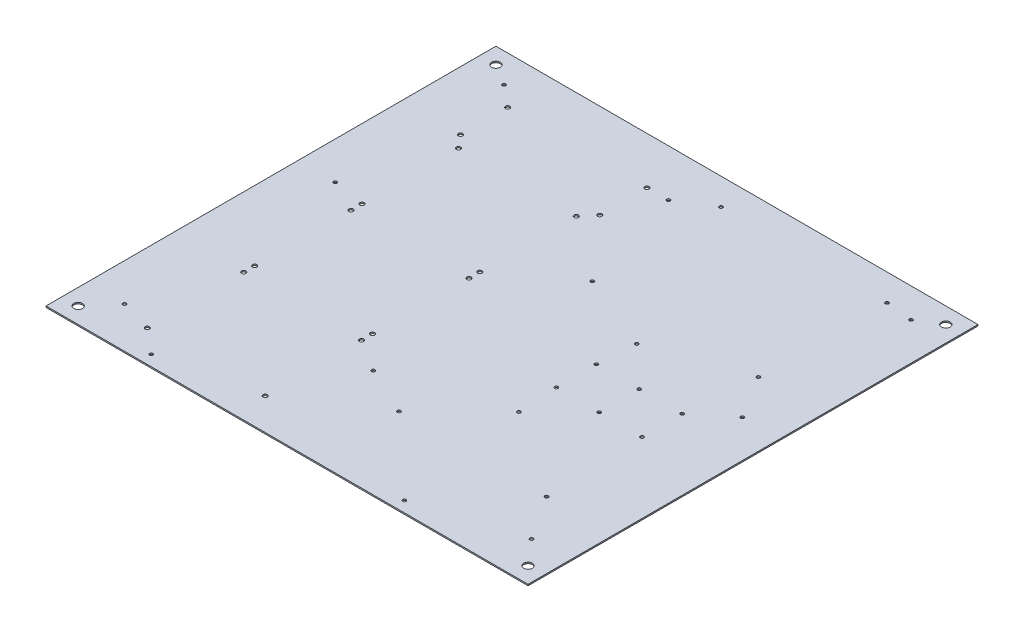
from build123d import *

# Parameters (mm, degrees)
SKETCH1_W               = 571.5
SKETCH1_H               = 533.4
BOSS_EXTRUDE1_DEPTH     = 1.5875
F_10_32_TAPPED_HOLE1_D  = 4.0386
F_1_4_20_TAPPED_HOLE1_D = 5.1054
F_10_32_TAPPED_HOLE2_D  = 4.0386
F_10_32_TAPPED_HOLE3_D  = 4.0386
F_3_8_CLEARANCE_HOLE1_D = 10.31748
F_10_32_TAPPED_HOLE4_D  = 4.0386


with BuildPart() as part:
    # Sketch1 → Boss-Extrude1 (new body)
    with BuildSketch(Plane(origin=(0, 0, 0), x_dir=(1, 0, 0), z_dir=(0, 1, 0))):
        with Locations((285.75, 266.7)):
            Rectangle(SKETCH1_W, SKETCH1_H)
    extrude(amount=BOSS_EXTRUDE1_DEPTH)

    # #10-32 Tapped Hole1 (through all)
    with Locations(Plane(origin=(0, 1.5875, 0), x_dir=(1, 0, 0), z_dir=(0, 1, 0))):
        with Locations((298.45, 501.65), (495.3, 501.65), (298.45, 349.25), (495.3, 349.25)):
            Hole(F_10_32_TAPPED_HOLE1_D / 2)

    # 1/4-20 Tapped Hole1 (through all)
    with Locations(Plane(origin=(0, 1.5875, 0), x_dir=(1, 0, 0), z_dir=(0, 1, 0))):
        with Locations((82.55, 406.4), (82.55, 292.1), (222.25, 292.1), (222.25, 406.4), (82.55, 279.146), (82.55, 164.846), (222.25, 164.846), (222.25, 279.146), (82.55, 151.892), (82.55, 37.592), (222.25, 37.592), (222.25, 151.892), (69.85, 477.52), (234.95, 421.64), (69.85, 421.64), (234.95, 477.52)):
            Hole(F_1_4_20_TAPPED_HOLE1_D / 2)

    # #10-32 Tapped Hole2 (through all)
    with Locations(Plane(origin=(0, 1.5875, 0), x_dir=(1, 0, 0), z_dir=(0, 1, 0))):
        with Locations((386.19999976, 266.324), (386.19999976, 218.826), (436.99999976, 266.324), (436.99999976, 218.826), (487.79999976, 266.324), (487.79999976, 218.826)):
            Hole(F_10_32_TAPPED_HOLE2_D / 2)

    # #10-32 Tapped Hole3 (through all)
    with Locations(Plane(origin=(0, 1.5875, 0), x_dir=(1, 0, 0), z_dir=(0, 1, 0))):
        with Locations((317.5, 100.975), (492.506, 100.975)):
            Hole(F_10_32_TAPPED_HOLE3_D / 2)

    # 3/8 Clearance Hole1 (through all)
    with Locations(Plane(origin=(0, 1.5875, 0), x_dir=(1, 0, 0), z_dir=(0, 1, 0))):
        with Locations((19.05, 514.35), (552.45, 514.35), (552.45, 19.05), (19.05, 19.05)):
            Hole(F_3_8_CLEARANCE_HOLE1_D / 2)

    # #10-32 Tapped Hole4 (through all)
    with Locations(Plane(origin=(0, 1.5875, 0), x_dir=(1, 0, 0), z_dir=(0, 1, 0))):
        with Locations((44.45, 498.5), (44.45, 48.5), (44.45, 298.5), (527.05, 48.5), (527.05, 498.5), (527.05, 298.5), (260.35, 127.65), (260.35, 477.65), (389.1, 311.15), (389.1, 171.45), (412.1, 12.7), (112.1, 12.7)):
            Hole(F_10_32_TAPPED_HOLE4_D / 2)


solid = part.part
